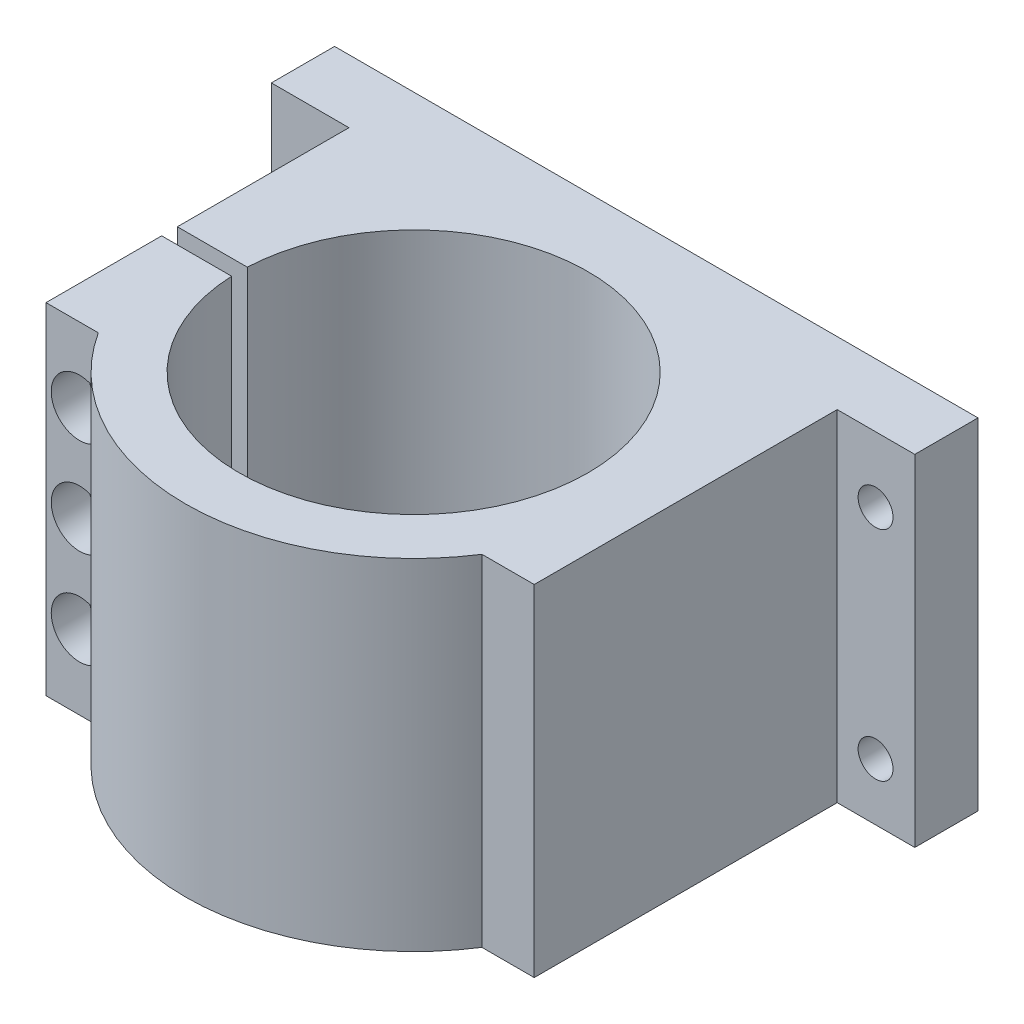
from build123d import *

# Parameters (mm, degrees)
SKETCH1_W               = 147.6
SKETCH1_H               = 78.1
BOSS_EXTRUDE1_DEPTH     = 14.5
SKETCH2_W               = 112
SKETCH2_H               = 78.1
BOSS_EXTRUDE2_DEPTH     = 93.5
CUT_EXTRUDE1_REACH      = 200.87
CUT_EXTRUDE2_DEPTH      = 8.4
CUT_EXTRUDE2_DEPTH_BACK = 8.4
SKETCH4_R               = 6.5
CUT_EXTRUDE3_REACH      = 185.305
SKETCH5_R               = 4
SKETCH7_R               = 4
CUT_EXTRUDE4_DEPTH      = 199.870234166


with BuildPart() as part:
    # Sketch1 → Boss-Extrude1 (new body)
    with BuildSketch(Plane.XY):
        with Locations((73.8, 39.05)):
            Rectangle(SKETCH1_W, SKETCH1_H)
    extrude(amount=BOSS_EXTRUDE1_DEPTH)

    # Sketch2 → Boss-Extrude2 (add)
    with BuildSketch(Plane.XY.offset(14.5)):
        with Locations((73.8, 39.05)):
            Rectangle(SKETCH2_W, SKETCH2_H)
    extrude(amount=BOSS_EXTRUDE2_DEPTH)

    # Sketch3 → Cut-Extrude1 (cut, up to next)
    with BuildSketch(Plane(origin=(0, 78.1, 0), x_dir=(1, 0, 0), z_dir=(0, 1, 0)), mode=Mode.PRIVATE) as cut_extrude1_sk1:
        with BuildLine():
            ThreePointArc((117.8, -84), (98.859928172, -101.609868316), (73.8, -108))
            Line((73.8, -108), (129.8, -108))
            Line((129.8, -108), (129.8, -84))
            Line((129.8, -84), (117.8, -84))
        make_face()
    cut_extrude1_tool1 = extrude(cut_extrude1_sk1.sketch, amount=-CUT_EXTRUDE1_REACH, mode=Mode.PRIVATE) & part.part
    # Sketch3 → Cut-Extrude1 (cut, up to next)
    with BuildSketch(Plane(origin=(0, 78.1, 0), x_dir=(1, 0, 0), z_dir=(0, 1, 0)), mode=Mode.PRIVATE) as cut_extrude1_sk2:
        with BuildLine():
            Line((29.8, -84), (17.8, -84))
            Line((17.8, -84), (17.8, -108))
            Line((17.8, -108), (73.8, -108))
            ThreePointArc((73.8, -108), (48.740071828, -101.609868316), (29.8, -84))
        make_face()
    cut_extrude1_tool2 = extrude(cut_extrude1_sk2.sketch, amount=-CUT_EXTRUDE1_REACH, mode=Mode.PRIVATE) & part.part
    # Sketch3 → Cut-Extrude1 (cut, up to next)
    with BuildSketch(Plane(origin=(0, 78.1, 0), x_dir=(1, 0, 0), z_dir=(0, 1, 0)), mode=Mode.PRIVATE) as cut_extrude1_sk3:
        with BuildLine():
            Line((17.8, -53.866666667), (17.8, -57.466666667))
            Line((17.8, -57.466666667), (33.840520524, -57.466666667))
            ThreePointArc((33.840520524, -57.466666667), (113.8, -55.666666667), (33.840520524, -53.866666667))
            Line((33.840520524, -53.866666667), (17.8, -53.866666667))
        make_face()
    cut_extrude1_tool3 = extrude(cut_extrude1_sk3.sketch, amount=-CUT_EXTRUDE1_REACH, mode=Mode.PRIVATE) & part.part
    add(cut_extrude1_tool1.solids().sort_by_distance((115.258406, 78.1, 98.707997))[0], mode=Mode.SUBTRACT)
    add(cut_extrude1_tool2.solids().sort_by_distance((32.341594, 78.1, 98.707997))[0], mode=Mode.SUBTRACT)
    add(cut_extrude1_tool3.solids().sort_by_distance((73.255815, 78.1, 55.666667))[0], mode=Mode.SUBTRACT)

    # Sketch4 → Cut-Extrude2 (cut, two sides: drawn at the far end of the back side and taken through both)
    with BuildSketch(Plane.XY.offset(84).offset(-CUT_EXTRUDE2_DEPTH_BACK)):
        with Locations((25.5, 61.05)):
            Circle(SKETCH4_R)
        with Locations((25.5, 39.05)):
            Circle(SKETCH4_R)
        with Locations((25.5, 17.05)):
            Circle(SKETCH4_R)
    extrude(amount=CUT_EXTRUDE2_DEPTH + CUT_EXTRUDE2_DEPTH_BACK, mode=Mode.SUBTRACT)

    # Sketch5 → Cut-Extrude3 (cut, up to next)
    with BuildSketch(Plane.XY.offset(75.6), mode=Mode.PRIVATE) as cut_extrude3_sk1:
        with Locations((25.5, 61.05)):
            Circle(SKETCH5_R)
    cut_extrude3_tool1 = extrude(cut_extrude3_sk1.sketch, amount=-CUT_EXTRUDE3_REACH, mode=Mode.PRIVATE) & part.part
    # Sketch5 → Cut-Extrude3 (cut, up to next)
    with BuildSketch(Plane.XY.offset(75.6), mode=Mode.PRIVATE) as cut_extrude3_sk2:
        with Locations((25.5, 39.05)):
            Circle(SKETCH5_R)
    cut_extrude3_tool2 = extrude(cut_extrude3_sk2.sketch, amount=-CUT_EXTRUDE3_REACH, mode=Mode.PRIVATE) & part.part
    # Sketch5 → Cut-Extrude3 (cut, up to next)
    with BuildSketch(Plane.XY.offset(75.6), mode=Mode.PRIVATE) as cut_extrude3_sk3:
        with Locations((25.5, 17.05)):
            Circle(SKETCH5_R)
    cut_extrude3_tool3 = extrude(cut_extrude3_sk3.sketch, amount=-CUT_EXTRUDE3_REACH, mode=Mode.PRIVATE) & part.part
    add(cut_extrude3_tool1.solids().sort_by_distance((25.5, 61.05, 75.6))[0], mode=Mode.SUBTRACT)
    add(cut_extrude3_tool2.solids().sort_by_distance((25.5, 39.05, 75.6))[0], mode=Mode.SUBTRACT)
    add(cut_extrude3_tool3.solids().sort_by_distance((25.5, 17.05, 75.6))[0], mode=Mode.SUBTRACT)

    # Sketch7 → Cut-Extrude4 (cut, through all)
    with BuildSketch(Plane(origin=(0, 0, 0), x_dir=(-1, 0, 0), z_dir=(0, 0, -1))):
        with Locations((-9, 63.1)):
            Circle(SKETCH7_R)
        with Locations((-9, 13.1)):
            Circle(SKETCH7_R)
        with Locations((-138.6, 13.1)):
            Circle(SKETCH7_R)
        with Locations((-138.6, 63.1)):
            Circle(SKETCH7_R)
    extrude(amount=-CUT_EXTRUDE4_DEPTH, mode=Mode.SUBTRACT)


solid = part.part
